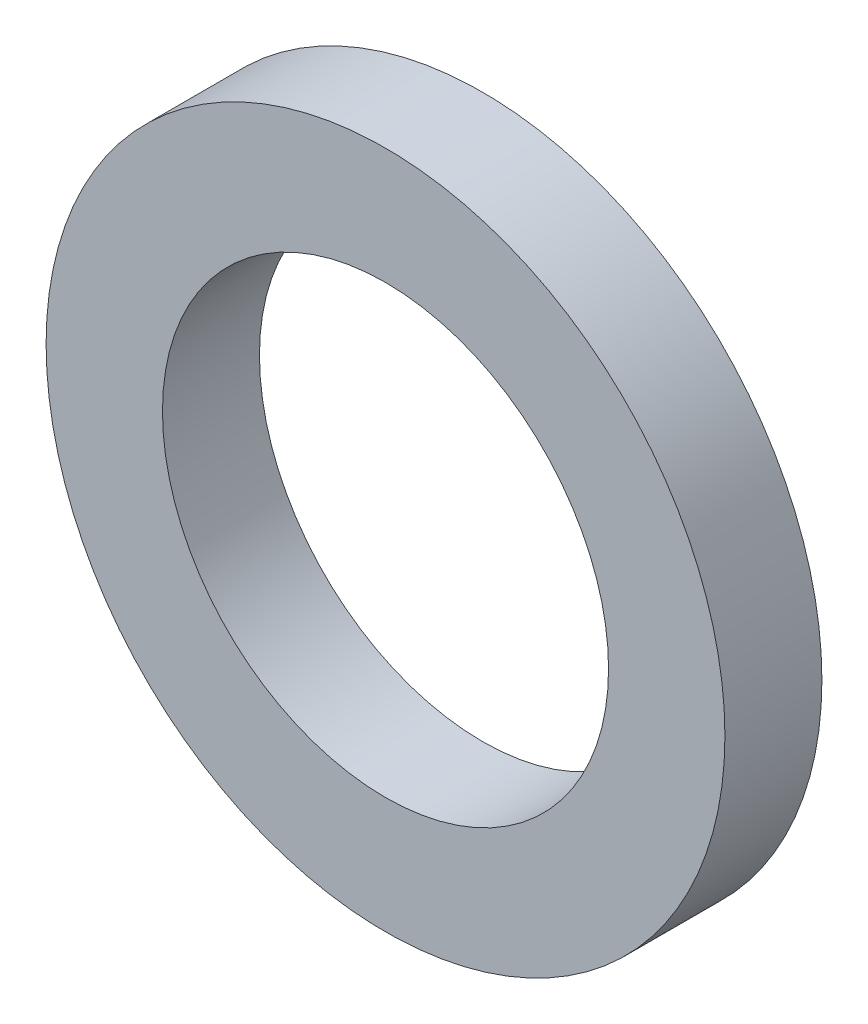
from build123d import *

# Parameters (mm, degrees)
SKETCH_1_R      = 17.5
SKETCH_1_R_2    = 11.5
EXTRUDE_1_DEPTH = 5


with BuildPart() as part:
    # 草图1 → 凸台-拉伸1 (new body)
    with BuildSketch(Plane.XY):
        Circle(SKETCH_1_R)
        Circle(SKETCH_1_R_2, mode=Mode.SUBTRACT)
    extrude(amount=EXTRUDE_1_DEPTH)


solid = part.part
